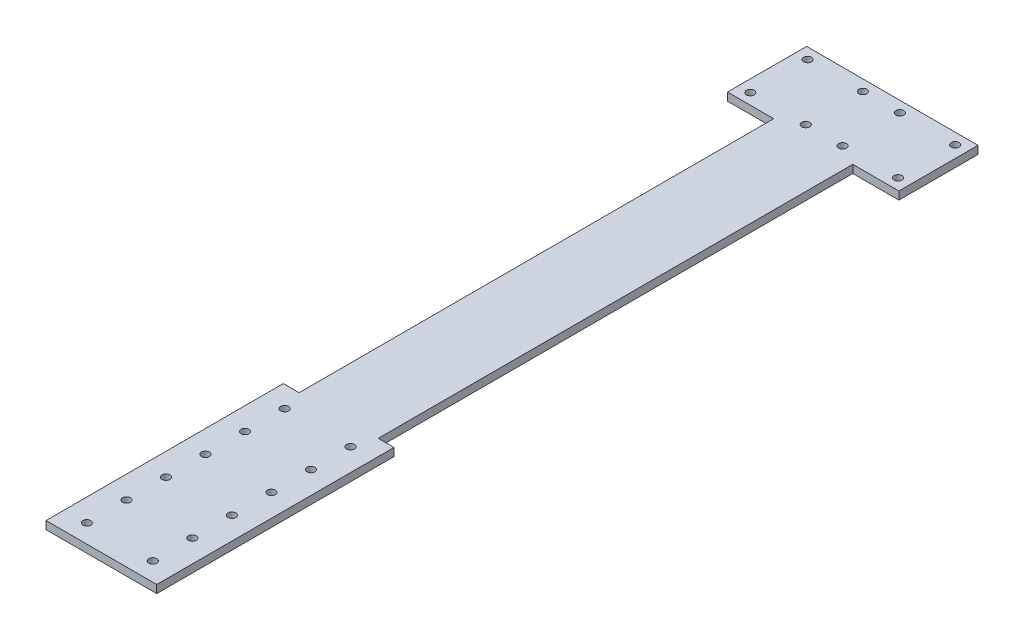
from build123d import *

# Parameters (mm, degrees)
BOSS_EXTRUDE1_DEPTH = 3
SKETCH2_R           = 1.5
CUT_EXTRUDE1_DEPTH  = 302.770194022
SKETCH3_R           = 1.5
CUT_EXTRUDE2_DEPTH  = 302.770194022
LPATTERN1_COUNT     = 6
LPATTERN1_PITCH     = 15


with BuildPart() as part:
    # Sketch1 → Boss-Extrude1 (new body)
    with BuildSketch(Plane(origin=(0, 0, 0), x_dir=(1, 0, 0), z_dir=(0, 1, 0))):
        Polygon((32.5, 300), (-32.5, 300), (-32.5, 270), (-15, 270), (-15, 90), (-21, 90), (-21, 0), (21, 0), (21, 90), (15, 90), (15, 270), (32.5, 270), align=None)
    extrude(amount=BOSS_EXTRUDE1_DEPTH)

    # Sketch2 → Cut-Extrude1 (cut, symmetric)
    with BuildSketch(Plane(origin=(0, 3, 0), x_dir=(1, 0, 0), z_dir=(0, 1, 0))):
        with Locations(Location((-28, 295.85, 0), (0, 0, 270))):
            Circle(SKETCH2_R)
        with Locations(Location((-7, 295.85, 0), (0, 0, 270))):
            Circle(SKETCH2_R)
        with Locations(Location((-28, 274.15, 0), (0, 0, 270))):
            Circle(SKETCH2_R)
        with Locations(Location((-7, 274.15, 0), (0, 0, 270))):
            Circle(SKETCH2_R)
    cut_extrude1 = extrude(amount=CUT_EXTRUDE1_DEPTH, both=True, mode=Mode.SUBTRACT)

    # Mirror1: Cut-Extrude1 across plane
    add(cut_extrude1.mirror(Plane(origin=(0, 0, 0), x_dir=(0, 0, 1), z_dir=(1, 0, 0))), mode=Mode.SUBTRACT)

    # Sketch3 → Cut-Extrude2 (cut, symmetric)
    with BuildSketch(Plane(origin=(0, 3, 0), x_dir=(1, 0, 0), z_dir=(0, 1, 0))):
        with BuildLine():
            ThreePointArc((-11, 82), (-11.439339828, 83.060660172), (-12.5, 83.5))
            Line((-12.5, 83.5), (-12.5, 80.5))
            ThreePointArc((-12.5, 80.5), (-11.439339828, 80.939339828), (-11, 82))
        make_face()
        with BuildLine():
            Line((-12.5, 80.5), (-12.5, 83.5))
            ThreePointArc((-12.5, 83.5), (-14, 82), (-12.5, 80.5))
        make_face()
        with Locations(Location((12.5, 82, 0), (0, 0, 270))):
            Circle(SKETCH3_R)
    cut_extrude2 = extrude(amount=CUT_EXTRUDE2_DEPTH, both=True, mode=Mode.SUBTRACT)

    # LPattern1: Cut-Extrude2 ×6
    with Locations(*[(0, 0, i * LPATTERN1_PITCH) for i in range(1, LPATTERN1_COUNT)]):
        add(cut_extrude2, mode=Mode.SUBTRACT)


solid = part.part
